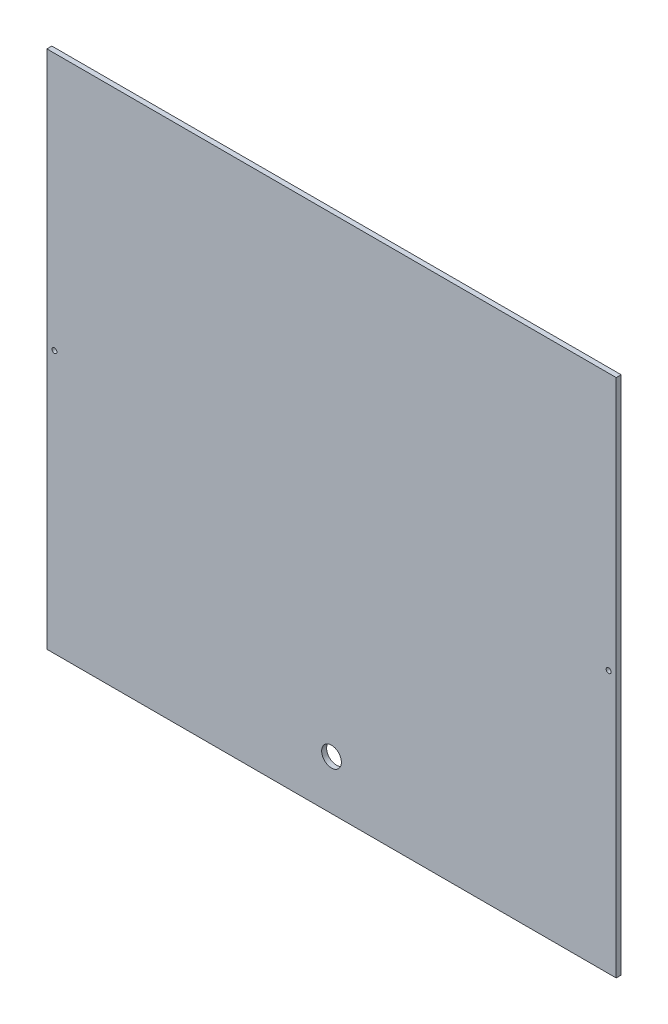
from build123d import *

# Parameters (mm, degrees)
SKETCH1_W           = 576.6975777
SKETCH1_H           = 526.6975777
SKETCH1_R           = 2.5
BOSS_EXTRUDE1_DEPTH = 5
SKETCH2_R           = 10
CUT_EXTRUDE1_DEPTH  = 10


with BuildPart() as part:
    # Sketch1 → Boss-Extrude1 (new body)
    with BuildSketch(Plane.XY):
        with Locations((288.34878885, 263.34878885)):
            Rectangle(SKETCH1_W, SKETCH1_H)
        with Locations((7.644193715, 265.84878885)):
            Circle(SKETCH1_R, mode=Mode.SUBTRACT)
        with Locations((569.053383985, 265.84878885)):
            Circle(SKETCH1_R, mode=Mode.SUBTRACT)
    extrude(amount=BOSS_EXTRUDE1_DEPTH)

    # Sketch2 → Cut-Extrude1 (cut)
    with BuildSketch(Plane(origin=(0, 0, 0), x_dir=(-1, 0, 0), z_dir=(0, 0, -1))):
        with Locations((-288.34878885, 50)):
            Circle(SKETCH2_R)
    extrude(amount=-CUT_EXTRUDE1_DEPTH, mode=Mode.SUBTRACT)


solid = part.part
